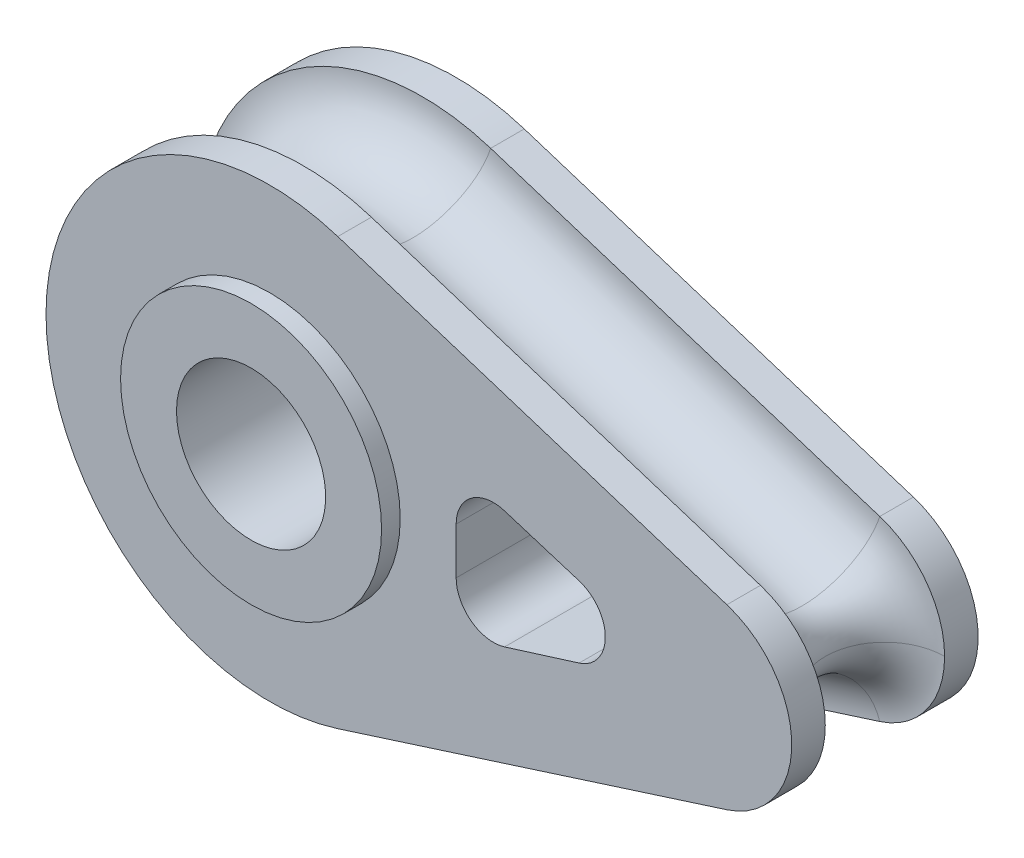
from build123d import *
from build123d.topology import SkipClean

# Parameters (mm, degrees)
SKETCH_1_R      = 20
EXTRUDE_1_DEPTH = 50
EXTRUDE_START   = 5
SKETCH_2_R      = 35
SKETCH_2_R_2    = 20
EXTRUDE_2_DEPTH = 5
SKETCH_3_R      = 16


with BuildPart() as part:
    # 草图1 → 凸台-拉伸1 (new body)
    with BuildSketch(Plane.XY):
        with BuildLine():
            Line((18.260869565, 57.153658174), (122.608695652, 23.814024239))
            ThreePointArc((122.608695652, 23.814024239), (140, 0), (122.608695652, -23.814024239))
            Line((122.608695652, -23.814024239), (18.260869565, -57.153658174))
            ThreePointArc((18.260869565, -57.153658174), (-60, 0), (18.260869565, 57.153658174))
        make_face()
        Circle(SKETCH_1_R, mode=Mode.SUBTRACT)
        with BuildLine():
            Line((50, -6.25), (50, 6.25))
            ThreePointArc((50, 6.25), (54.076635218, 14.306906953), (62.982749931, 15.79479978))
            Line((62.982749931, 15.79479978), (82.982749931, 9.54479978))
            ThreePointArc((82.982749931, 9.54479978), (90, 0), (82.982749931, -9.54479978))
            Line((82.982749931, -9.54479978), (62.982749931, -15.79479978))
            ThreePointArc((62.982749931, -15.79479978), (54.076635218, -14.306906953), (50, -6.25))
        make_face(mode=Mode.SUBTRACT)
    extrude(amount=EXTRUDE_1_DEPTH)

    # 草图2 → 凸台-拉伸2 (add)
    with SkipClean():  # the faces are left unmerged after this step: merging them gives an invalid solid
        with BuildSketch(Plane(origin=(0, 0, 0), x_dir=(-1, 0, 0), z_dir=(0, 0, -1)).offset(EXTRUDE_START)):
            with Locations(Location((0, 0, 0), (0, 0, 180))):
                Circle(SKETCH_2_R)
            Circle(SKETCH_2_R_2, mode=Mode.SUBTRACT)
        extrude_2 = extrude(amount=-EXTRUDE_2_DEPTH)

    # 镜向1: 凸台-拉伸2 across plane
    add(extrude_2.mirror(Plane(origin=(0, 0, 25), x_dir=(1, 0, 0), z_dir=(0, 0, -1))))

    # 切除-扫描1: sweep along a path in 草图6
    with BuildLine(Plane(origin=(0, 0, 25), x_dir=(-1, 0, 0), z_dir=(0, 0, -1))) as sweep_1_path:
        Line((-122.608695652, 23.814024239), (-18.260869565, 57.153658174))
        ThreePointArc((-18.260869565, 57.153658174), (60, 0), (-18.260869565, -57.153658174))
        Line((-18.260869565, -57.153658174), (-122.608695652, -23.814024239))
        ThreePointArc((-122.608695652, -23.814024239), (-140, 0), (-122.608695652, 23.814024239))
    # 草图3 → 切除-扫描1 (sweep, cut)
    with BuildSketch(Plane(origin=(0, 0, 0), x_dir=(-1, 0, 0), z_dir=(0, -1, 0))):
        with Locations((-140, -25)):
            Circle(SKETCH_3_R)
    sweep(path=sweep_1_path.line, mode=Mode.SUBTRACT)


solid = part.part
